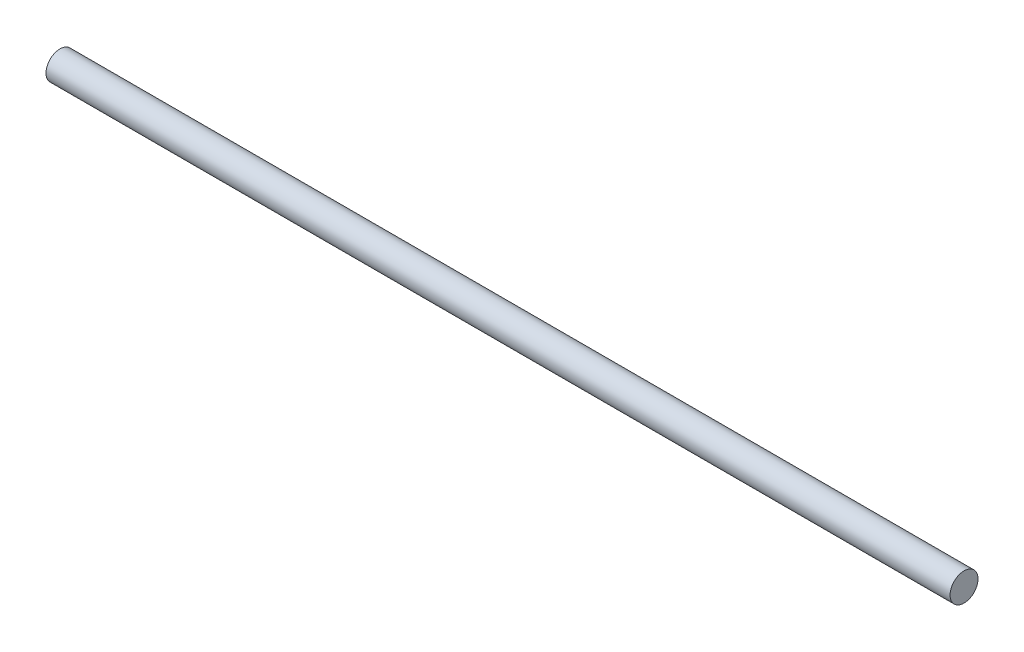
from build123d import *

# Parameters (mm, degrees)
SKETCH1_R           = 1.5
BOSS_EXTRUDE1_DEPTH = 97


with BuildPart() as part:
    # Sketch1 → Boss-Extrude1 (new body)
    with BuildSketch(Plane(origin=(0, 0, 0), x_dir=(0, 0, -1), z_dir=(1, 0, 0))):
        with Locations(Location((0, 0, 0), (0, 0, 180))):
            Circle(SKETCH1_R)
    extrude(amount=BOSS_EXTRUDE1_DEPTH)


solid = part.part
